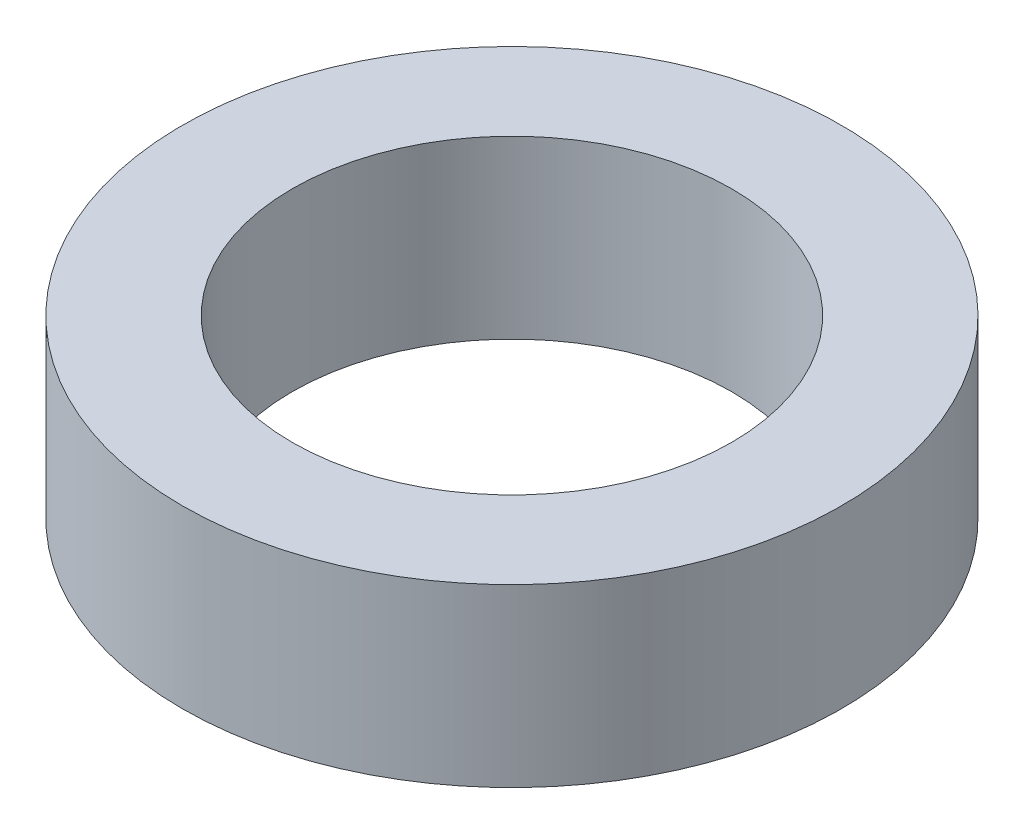
from build123d import *

# Parameters (mm, degrees)
SKETCH_1_R      = 7.5
SKETCH_1_R_2    = 5
EXTRUDE_1_DEPTH = 4


with BuildPart() as part:
    # 草图1 → 凸台-拉伸1 (new body)
    with BuildSketch(Plane(origin=(0, 0, 0), x_dir=(1, 0, 0), z_dir=(0, 1, 0))):
        with Locations(Location((0, 0, 0), (0, 0, 270))):
            Circle(SKETCH_1_R)
        with Locations(Location((0, 0, 0), (0, 0, 270))):
            Circle(SKETCH_1_R_2, mode=Mode.SUBTRACT)
    extrude(amount=EXTRUDE_1_DEPTH)


solid = part.part
